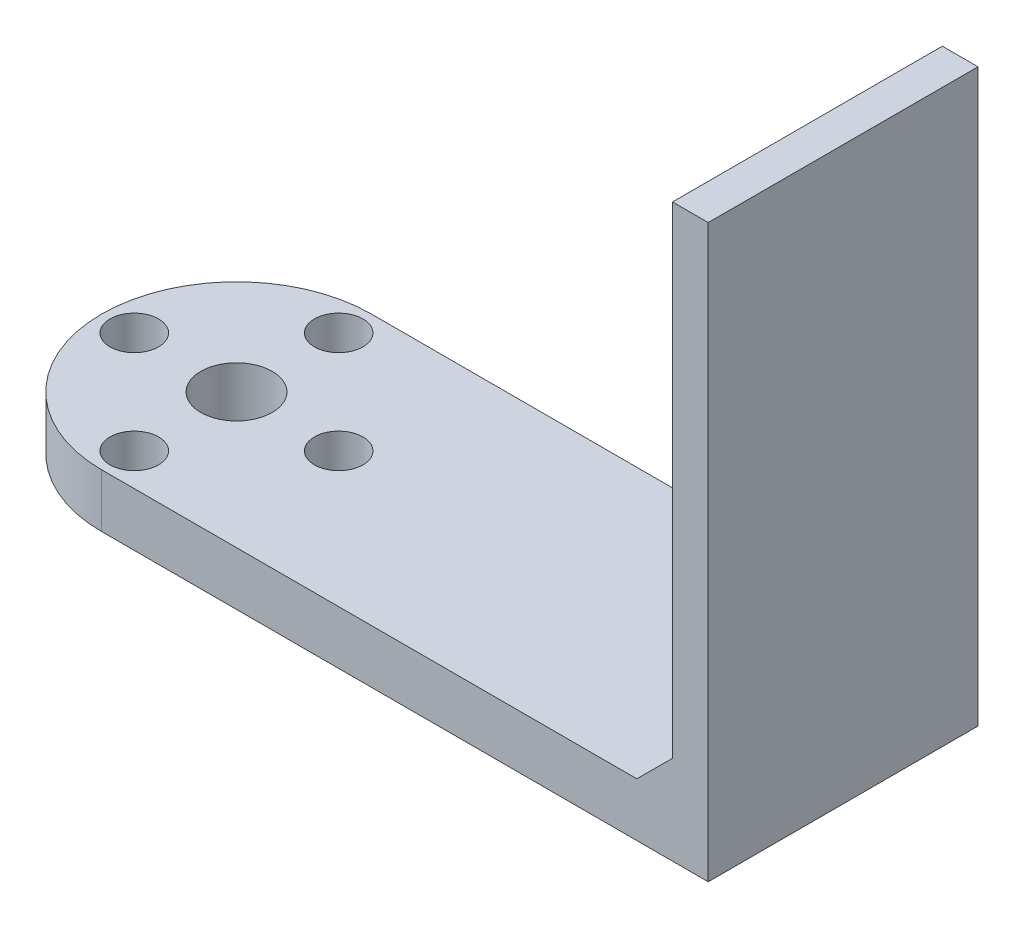
from build123d import *

# Parameters (mm, degrees)
SKETCH1_R           = 2.159
SKETCH1_R_2         = 3.175
BOSS_EXTRUDE1_DEPTH = 4.7625
SKETCH1_3_W         = 3.175
SKETCH1_3_H         = 24.003
BOSS_EXTRUDE2_DEPTH = 50.8
CHAMFER1_SIZE       = 3.175


with BuildPart() as part:
    # Sketch1 → Boss-Extrude1 (new body)
    with BuildSketch(Plane(origin=(0, 0, 0), x_dir=(1, 0, 0), z_dir=(0, 1, 0))):
        with BuildLine():
            Line((0, -12.0015), (50.8, -12.0015))
            Line((50.8, -12.0015), (50.8, 12.0015))
            Line((50.8, 12.0015), (0, 12.0015))
            ThreePointArc((0, 12.0015), (-12.0015, 0), (0, -12.0015))
        make_face()
        with Locations((0, -9.0932)):
            Circle(SKETCH1_R, mode=Mode.SUBTRACT)
        with Locations((-9.0932, 0)):
            Circle(SKETCH1_R, mode=Mode.SUBTRACT)
        Circle(SKETCH1_R_2, mode=Mode.SUBTRACT)
        with Locations((9.0932, 0)):
            Circle(SKETCH1_R, mode=Mode.SUBTRACT)
        with Locations((0, 9.0932)):
            Circle(SKETCH1_R, mode=Mode.SUBTRACT)
    extrude(amount=BOSS_EXTRUDE1_DEPTH)

    # Sketch1<3> → Boss-Extrude2 (add)
    with BuildSketch(Plane(origin=(0, 0, 0), x_dir=(1, 0, 0), z_dir=(0, 1, 0))):
        with Locations((52.3875, 0)):
            Rectangle(SKETCH1_3_W, SKETCH1_3_H)
    extrude(amount=BOSS_EXTRUDE2_DEPTH)

    # Chamfer1
    chamfer1_edges = [part.edges().sort_by_distance(p)[0] for p in [
        (50.8, 4.7625, 0),
    ]]
    chamfer(chamfer1_edges, length=CHAMFER1_SIZE)


solid = part.part
